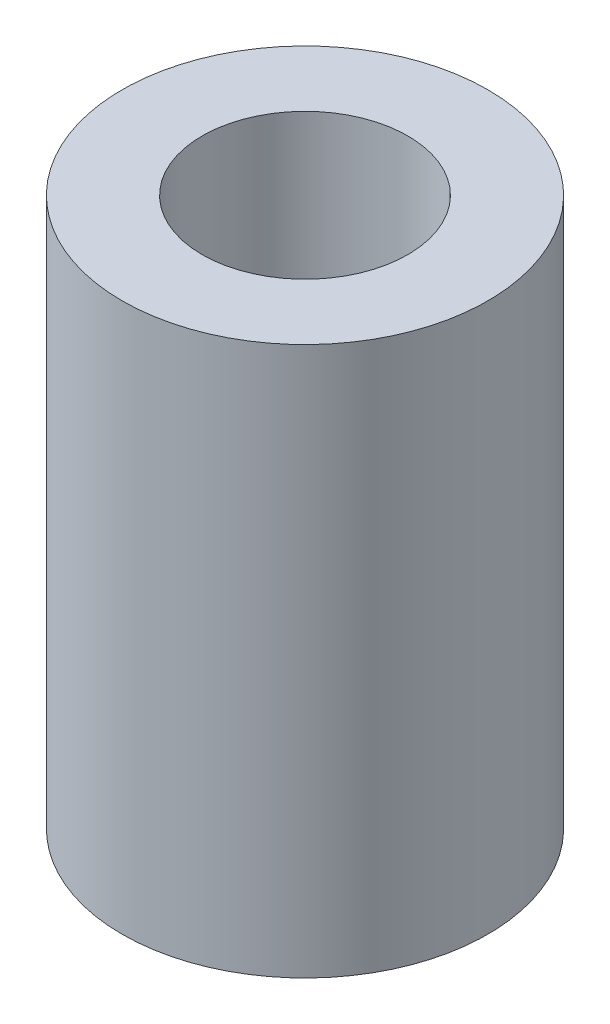
from build123d import *

# Parameters (mm, degrees)
SKETCH1_R           = 4
SKETCH1_R_2         = 2.25
BOSS_EXTRUDE1_DEPTH = 12


with BuildPart() as part:
    # Sketch1 → Boss-Extrude1 (new body)
    with BuildSketch(Plane(origin=(0, 0, 0), x_dir=(1, 0, 0), z_dir=(0, 1, 0))):
        with Locations(Location((0, 0, 0), (0, 0, 270))):
            Circle(SKETCH1_R)
        with Locations(Location((0, 0, 0), (0, 0, 270))):
            Circle(SKETCH1_R_2, mode=Mode.SUBTRACT)
    extrude(amount=BOSS_EXTRUDE1_DEPTH)


solid = part.part
